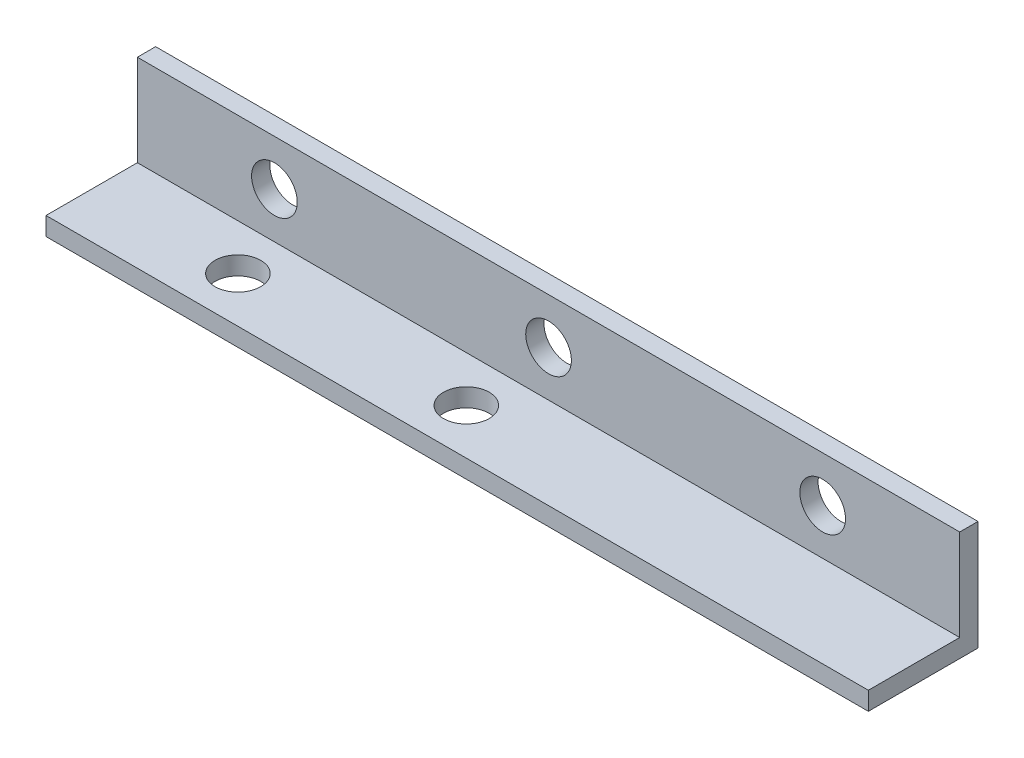
from build123d import *

# Parameters (mm, degrees)
SKETCH1_W               = 90
SKETCH1_H               = 12
BOSS_EXTRUDE1_DEPTH     = 2
SKETCH2_W               = 90
SKETCH2_H               = 2
BOSS_EXTRUDE2_DEPTH     = 10
CUT_EXTRUDE1_DEPTH      = 63.420894383
CUT_EXTRUDE1_DEPTH_BACK = 63.420894383
SKETCH3_R               = 2.5
CUT_EXTRUDE2_DEPTH      = 64.477248768
CUT_EXTRUDE2_DEPTH_BACK = 64.477248768
SKETCH4_R               = 2.5


with BuildPart() as part:
    # Sketch1 → Boss-Extrude1 (new body)
    with BuildSketch(Plane(origin=(0, 0, 0), x_dir=(1, 0, 0), z_dir=(0, 1, 0))):
        with Locations((-16.166666667, 1.416666667)):
            Rectangle(SKETCH1_W, SKETCH1_H)
    extrude(amount=BOSS_EXTRUDE1_DEPTH)

    # Sketch2 → Boss-Extrude2 (add)
    with BuildSketch(Plane(origin=(0, 2, 0), x_dir=(1, 0, 0), z_dir=(0, 1, 0))):
        with Locations((-16.166666667, 6.416666667)):
            Rectangle(SKETCH2_W, SKETCH2_H)
    extrude(amount=BOSS_EXTRUDE2_DEPTH)

    # Sketch3 → Cut-Extrude1 (cut, two sides: drawn at the far end of the back side and taken through both)
    with BuildSketch(Plane(origin=(0, 2, 0), x_dir=(1, 0, 0), z_dir=(0, 1, 0)).offset(-CUT_EXTRUDE1_DEPTH_BACK)):
        with Locations(Location((-45.166666667, 0.416666667, 0), (0, 0, 270))):
            Circle(SKETCH3_R)
        with Locations(Location((-20.166666667, 0.416666667, 0), (0, 0, 270))):
            Circle(SKETCH3_R)
    extrude(amount=CUT_EXTRUDE1_DEPTH + CUT_EXTRUDE1_DEPTH_BACK, mode=Mode.SUBTRACT)

    # Sketch4 → Cut-Extrude2 (cut, two sides: drawn at the far end of the back side and taken through both)
    with BuildSketch(Plane(origin=(0, 0, -7.416666667), x_dir=(-1, 0, 0), z_dir=(0, 0, -1)).offset(-CUT_EXTRUDE2_DEPTH_BACK)):
        with Locations((-13.833333333, 7)):
            Circle(SKETCH4_R)
        with Locations((16.166666667, 7)):
            Circle(SKETCH4_R)
        with Locations((46.166666667, 7)):
            Circle(SKETCH4_R)
    extrude(amount=CUT_EXTRUDE2_DEPTH + CUT_EXTRUDE2_DEPTH_BACK, mode=Mode.SUBTRACT)


solid = part.part
